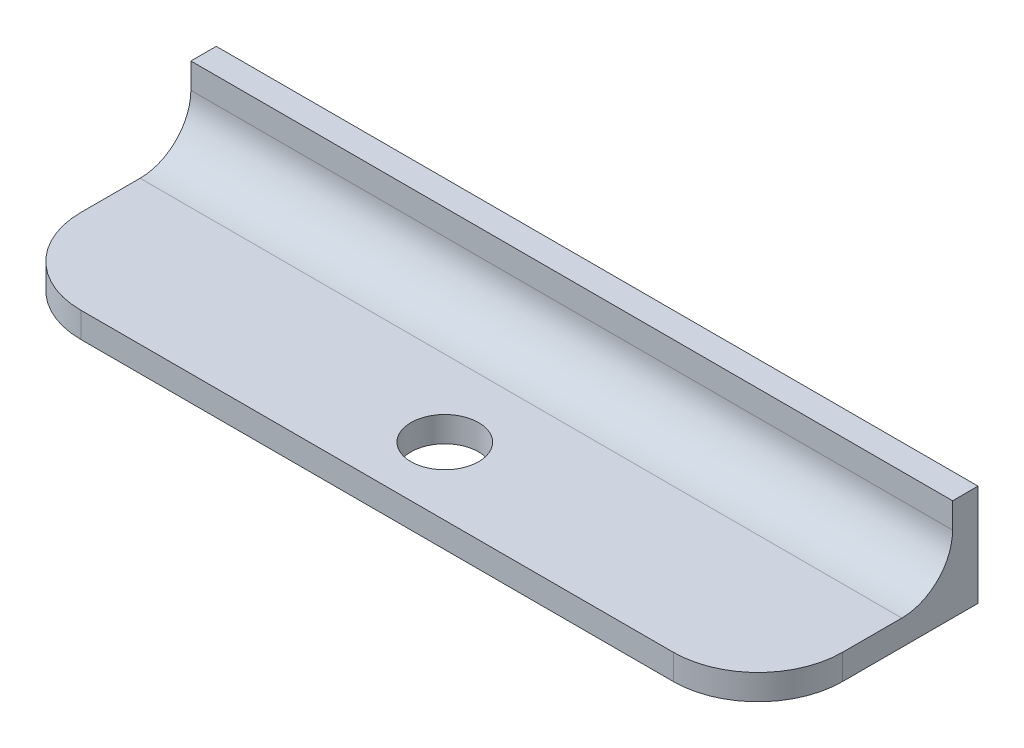
from build123d import *

# Parameters (mm, degrees)
SKETCH1_R           = 2
BOSS_EXTRUDE1_DEPTH = 1.5
SKETCH2_W           = 45
SKETCH2_H           = 1.5
BOSS_EXTRUDE2_DEPTH = 4.5
FILLET1_R           = 3


with BuildPart() as part:
    # Sketch1 → Boss-Extrude1 (new body)
    with BuildSketch(Plane(origin=(0, 0, 0), x_dir=(1, 0, 0), z_dir=(0, 1, 0))):
        with BuildLine():
            Line((-22.5, 9), (22.5, 9))
            Line((22.5, 9), (22.5, 1))
            ThreePointArc((22.5, 1), (21.035533906, -2.535533906), (17.5, -4))
            Line((17.5, -4), (-17.5, -4))
            ThreePointArc((-17.5, -4), (-21.035533906, -2.535533906), (-22.5, 1))
            Line((-22.5, 1), (-22.5, 9))
        make_face()
        with Locations(Location((0, 0, 0), (0, 0, 270))):
            Circle(SKETCH1_R, mode=Mode.SUBTRACT)
    extrude(amount=BOSS_EXTRUDE1_DEPTH)

    # Sketch2 → Boss-Extrude2 (add)
    with BuildSketch(Plane(origin=(0, 1.5, 0), x_dir=(1, 0, 0), z_dir=(0, 1, 0))):
        with Locations((0, 8.25)):
            Rectangle(SKETCH2_W, SKETCH2_H)
    extrude(amount=BOSS_EXTRUDE2_DEPTH)

    # Fillet1
    fillet1_edges = [part.edges().sort_by_distance(p)[0] for p in [
        (0, 1.5, -7.5),
    ]]
    fillet(fillet1_edges, radius=FILLET1_R)


solid = part.part
